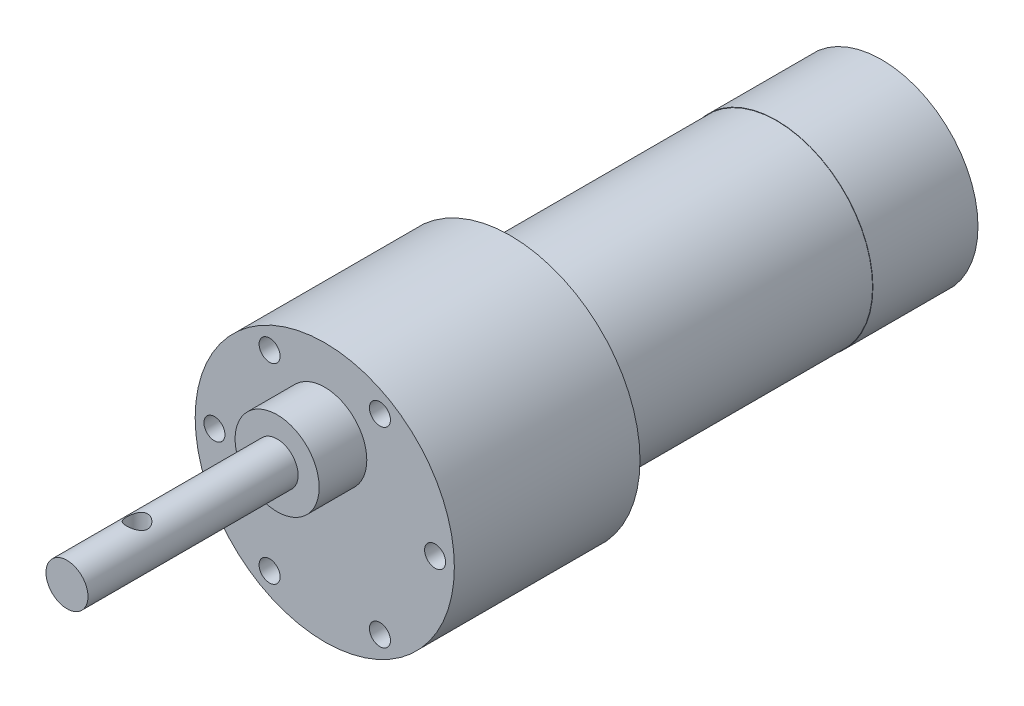
from build123d import *

# Parameters (mm, degrees)
SKETCH1_R           = 18.5
BOSS_EXTRUDE1_DEPTH = 26.5
SKETCH2_R           = 13.7
BOSS_EXTRUDE2_DEPTH = 38
SKETCH3_R           = 6
BOSS_EXTRUDE3_DEPTH = 6.8
SKETCH4_R           = 3
BOSS_EXTRUDE4_DEPTH = 30
SKETCH5_R           = 1.5
CUT_EXTRUDE1_DEPTH  = 6
CIRPATTERN1_COUNT   = 6
SKETCH6_R           = 13.75
BOSS_EXTRUDE5_DEPTH = 15
SKETCH7_R           = 1.5
CUT_EXTRUDE2_DEPTH  = 69.49372234


with BuildPart() as part:
    # Sketch1 → Boss-Extrude1 (new body)
    with BuildSketch(Plane.XY):
        Circle(SKETCH1_R)
    extrude(amount=BOSS_EXTRUDE1_DEPTH)

    # Sketch2 → Boss-Extrude2 (add)
    with BuildSketch(Plane(origin=(0, 0, 0), x_dir=(-1, 0, 0), z_dir=(0, 0, -1))):
        with Locations(Location((0, 0, 0), (0, 0, 180))):
            Circle(SKETCH2_R)
    extrude(amount=BOSS_EXTRUDE2_DEPTH)

    # Sketch3 → Boss-Extrude3 (add)
    with BuildSketch(Plane.XY.offset(26.5)):
        with Locations((0, 7)):
            Circle(SKETCH3_R)
    extrude(amount=BOSS_EXTRUDE3_DEPTH)

    # Sketch4 → Boss-Extrude4 (add)
    with BuildSketch(Plane.XY.offset(33.3)):
        with Locations((0, 7)):
            Circle(SKETCH4_R)
    extrude(amount=BOSS_EXTRUDE4_DEPTH)

    # Sketch5 → Cut-Extrude1 (cut)
    with BuildSketch(Plane.XY.offset(26.5)):
        with Locations((15.75, 0)):
            Circle(SKETCH5_R)
    cut_extrude1 = extrude(amount=-CUT_EXTRUDE1_DEPTH, mode=Mode.SUBTRACT)

    # CirPattern1: Cut-Extrude1 ×6 about axis
    cirpattern1_axis = Axis((0, 0, 0), (0, 0, 1))
    for i in range(1, CIRPATTERN1_COUNT):
        add(cut_extrude1.rotate(cirpattern1_axis, i * 360 / CIRPATTERN1_COUNT), mode=Mode.SUBTRACT)

    # Sketch6 → Boss-Extrude5 (add)
    with BuildSketch(Plane(origin=(0, 0, -38), x_dir=(-1, 0, 0), z_dir=(0, 0, -1))):
        Circle(SKETCH6_R)
    extrude(amount=BOSS_EXTRUDE5_DEPTH)

    # Sketch7 → Cut-Extrude2 (cut, through all)
    with BuildSketch(Plane(origin=(0, 0, 0), x_dir=(1, 0, 0), z_dir=(0, 1, 0))):
        with Locations(Location((0, -53.3, 0), (0, 0, 90))):
            Circle(SKETCH7_R)
    extrude(amount=CUT_EXTRUDE2_DEPTH, mode=Mode.SUBTRACT)


solid = part.part
